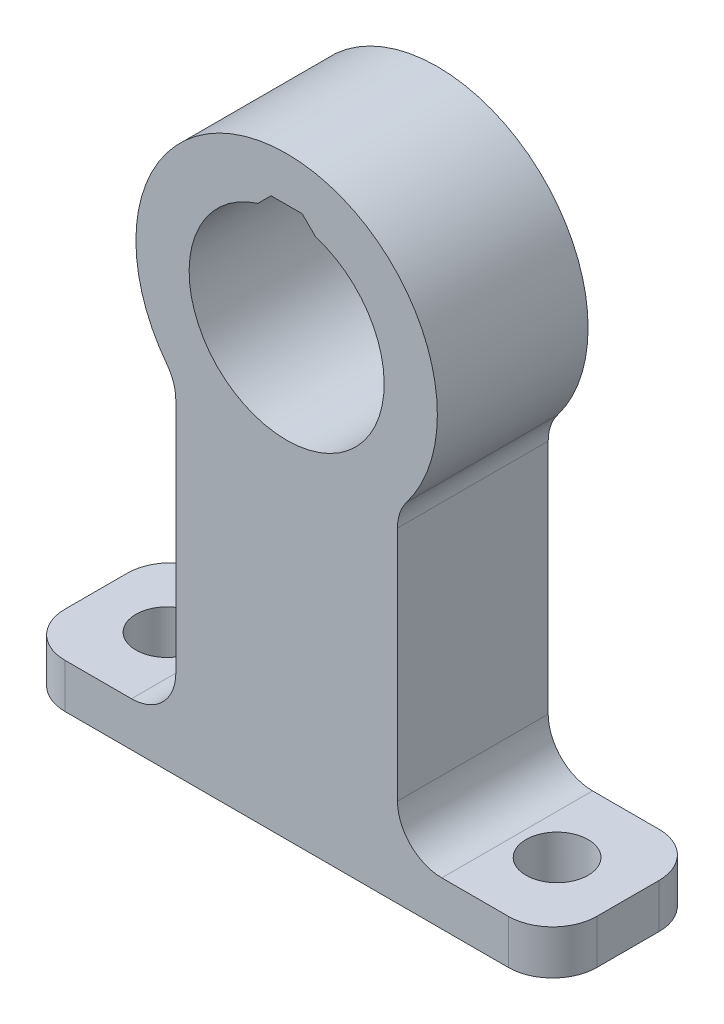
from build123d import *

# Parameters (mm, degrees)
BOSS_EXTRUDE1_DEPTH = 17
CUT_EXTRUDE1_REACH  = 77.353
SKETCH2_R           = 3.5
FILLET1_R           = 5


with BuildPart() as part:
    # Sketch1 → Boss-Extrude1 (new body)
    with BuildSketch(Plane.XY):
        with BuildLine():
            Line((-12.5, -11.521718622), (-12.5, -45))
            Line((-12.5, -45), (-30, -45))
            Line((-30, -45), (-30, -50))
            Line((-30, -50), (30, -50))
            Line((30, -50), (30, -45))
            Line((30, -45), (12.5, -45))
            Line((12.5, -45), (12.5, -11.521718622))
            ThreePointArc((12.5, -11.521718622), (0, 17), (-12.5, -11.521718622))
        make_face()
        with BuildLine():
            Line((-3.25, 10.508924778), (-1.758924778, 12))
            Line((-1.758924778, 12), (1.758924778, 12))
            Line((1.758924778, 12), (3.25, 10.508924778))
            ThreePointArc((3.25, 10.508924778), (0, -11), (-3.25, 10.508924778))
        make_face(mode=Mode.SUBTRACT)
    extrude(amount=BOSS_EXTRUDE1_DEPTH)

    # Sketch2 → Cut-Extrude1 (cut, up to next)
    with BuildSketch(Plane.XZ.offset(50), mode=Mode.PRIVATE) as cut_extrude1_sk1:
        with Locations(Location((-22, 8.5, 0), (0, 0, 270))):
            Circle(SKETCH2_R)
    cut_extrude1_tool1 = extrude(cut_extrude1_sk1.sketch, amount=-CUT_EXTRUDE1_REACH, mode=Mode.PRIVATE) & part.part
    # Sketch2 → Cut-Extrude1 (cut, up to next)
    with BuildSketch(Plane.XZ.offset(50), mode=Mode.PRIVATE) as cut_extrude1_sk2:
        with Locations((22, 8.5)):
            Circle(SKETCH2_R)
    cut_extrude1_tool2 = extrude(cut_extrude1_sk2.sketch, amount=-CUT_EXTRUDE1_REACH, mode=Mode.PRIVATE) & part.part
    add(cut_extrude1_tool1.solids().sort_by_distance((-22, -50, 8.5))[0], mode=Mode.SUBTRACT)
    add(cut_extrude1_tool2.solids().sort_by_distance((22, -50, 8.5))[0], mode=Mode.SUBTRACT)

    # Fillet1
    fillet1_edges = [part.edges().sort_by_distance(p)[0] for p in [
        (-12.5, -45, 8.5),
        (-12.5, -11.521718622, 8.5),
        (12.5, -11.521718622, 8.5),
        (12.5, -45, 8.5),
        (-30, -47.5, 17),
        (30, -47.5, 17),
        (30, -47.5, 0),
        (-30, -47.5, 0),
    ]]
    fillet(fillet1_edges, radius=FILLET1_R)


solid = part.part
